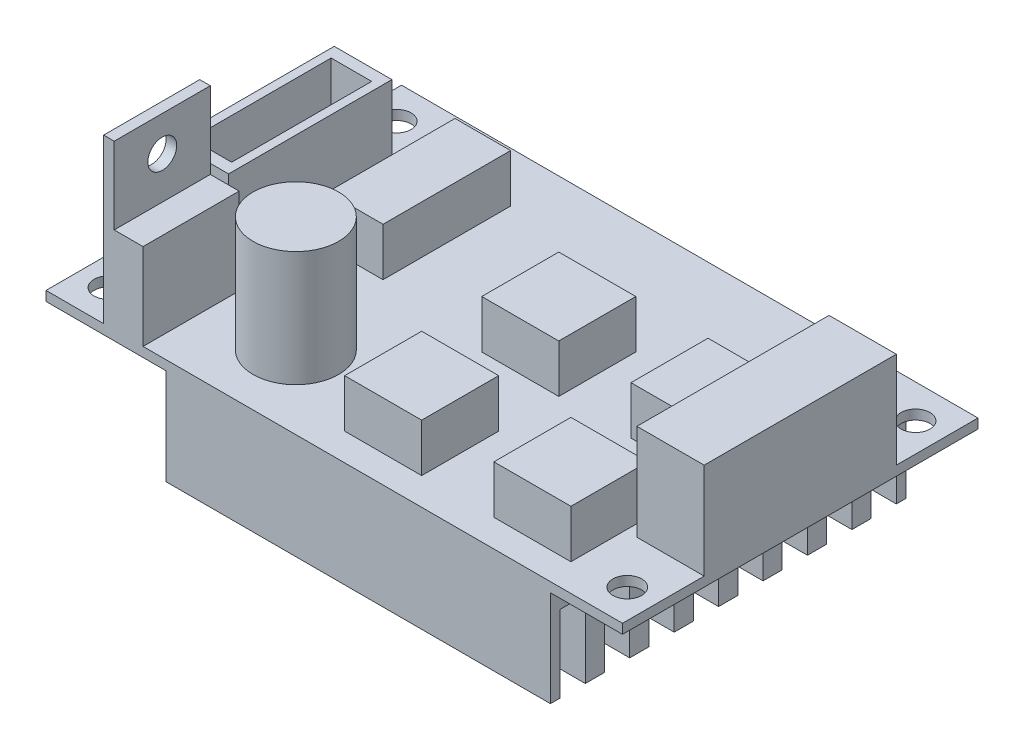
from build123d import *

# Parameters (mm, degrees)
SKETCH_1_W          = 60
SKETCH_1_H          = 37
SKETCH_1_R          = 1.5
EXTRUDE_1_DEPTH     = 1
SKETCH_2_W          = 18
SKETCH_2_H          = 20
EXTRUDE_2_DEPTH     = 10
SKETCH_3_R          = 1
CUT_EXTRUDE_1_DEPTH = 1
SKETCH_4_W          = 1.889309118
SKETCH_4_H          = 3.828785833
CUT_EXTRUDE_2_DEPTH = 5
SKETCH_5_W          = 6
SKETCH_5_H          = 17
EXTRUDE_3_DEPTH     = 7
SKETCH_6_W          = 4.219200818
SKETCH_6_H          = 14.571651166
CUT_EXTRUDE_3_DEPTH = 7
SKETCH_7_W          = 1.099481737
SKETCH_7_H          = 10
EXTRUDE_4_DEPTH     = 17
SKETCH_8_W          = 3
SKETCH_8_H          = 10
EXTRUDE_5_DEPTH     = 9
SKETCH_9_R          = 1.5
CUT_EXTRUDE_4_DEPTH = 9
SKETCH_10_W         = 8.015050441
SKETCH_10_H         = 8.015050442
SKETCH_10_W_2       = 5.788647541
SKETCH_10_H_2       = 13.284723362
EXTRUDE_7_DEPTH     = 5
SKETCH_11_R         = 4.452805801
EXTRUDE_8_DEPTH     = 12
SKETCH_12_W         = 40
SKETCH_12_H         = 37
EXTRUDE_9_DEPTH     = 10
SKETCH_13_W         = 2.63
SKETCH_13_H         = 7.995738943
CUT_EXTRUDE_5_DEPTH = 64.941379403
SKETCH_14_W         = 11
SKETCH_14_H         = 20
CUT_EXTRUDE_6_DEPTH = 49.448426187


with BuildPart() as part:
    # 草图1 → 凸台-拉伸1 (new body)
    with BuildSketch(Plane(origin=(0, 0, 0), x_dir=(1, 0, 0), z_dir=(0, 1, 0))):
        Rectangle(SKETCH_1_W, SKETCH_1_H)
        with Locations(Location((27, 15, 0), (0, 0, 270))):
            Circle(SKETCH_1_R, mode=Mode.SUBTRACT)
        with Locations(Location((27, -15, 0), (0, 0, 90))):
            Circle(SKETCH_1_R, mode=Mode.SUBTRACT)
        with Locations(Location((-27, -15, 0), (0, 0, 270))):
            Circle(SKETCH_1_R, mode=Mode.SUBTRACT)
        with Locations(Location((-27, 15, 0), (0, 0, 90))):
            Circle(SKETCH_1_R, mode=Mode.SUBTRACT)
    extrude(amount=EXTRUDE_1_DEPTH)

    # 草图2 → 凸台-拉伸2 (add)
    with BuildSketch(Plane(origin=(0, 1, 0), x_dir=(1, 0, 0), z_dir=(0, 1, 0))):
        with Locations((32, 0)):
            Rectangle(SKETCH_2_W, SKETCH_2_H)
    extrude(amount=EXTRUDE_2_DEPTH)

    # 草图3 → 切除-拉伸1 (cut)
    with BuildSketch(Plane(origin=(0, 11, 0), x_dir=(1, 0, 0), z_dir=(0, 1, 0))):
        with Locations(Location((38.562083072, 7.5, 0), (0, 0, 270))):
            Circle(SKETCH_3_R)
        with Locations(Location((38.562083072, 2.5, 0), (0, 0, 270))):
            Circle(SKETCH_3_R)
        with Locations(Location((38.562083072, -7.5, 0), (0, 0, 90))):
            Circle(SKETCH_3_R)
        with Locations(Location((38.562083072, -2.5, 0), (0, 0, 90))):
            Circle(SKETCH_3_R)
    extrude(amount=-CUT_EXTRUDE_1_DEPTH, mode=Mode.SUBTRACT)

    # 草图4 → 切除-拉伸2 (cut)
    with BuildSketch(Plane(origin=(41, 0, 0), x_dir=(0, 0, -1), z_dir=(1, 0, 0))):
        with Locations((-2.5, 3.73063685)):
            Rectangle(SKETCH_4_W, SKETCH_4_H)
        with Locations((-7.5, 3.73063685)):
            Rectangle(SKETCH_4_W, SKETCH_4_H)
        with Locations((2.5, 3.73063685)):
            Rectangle(SKETCH_4_W, SKETCH_4_H)
        with Locations((7.5, 3.73063685)):
            Rectangle(SKETCH_4_W, SKETCH_4_H)
    extrude(amount=-CUT_EXTRUDE_2_DEPTH, mode=Mode.SUBTRACT)

    # 草图5 → 凸台-拉伸3 (add)
    with BuildSketch(Plane(origin=(0, 1, 0), x_dir=(1, 0, 0), z_dir=(0, 1, 0))):
        with Locations((-27, 3)):
            Rectangle(SKETCH_5_W, SKETCH_5_H)
    extrude(amount=EXTRUDE_3_DEPTH)

    # 草图6 → 切除-拉伸3 (cut)
    with BuildSketch(Plane(origin=(0, 8, 0), x_dir=(1, 0, 0), z_dir=(0, 1, 0))):
        with Locations((-27, 3)):
            Rectangle(SKETCH_6_W, SKETCH_6_H)
    extrude(amount=-CUT_EXTRUDE_3_DEPTH, mode=Mode.SUBTRACT)

    # 草图7 → 凸台-拉伸4 (add)
    with BuildSketch(Plane(origin=(0, 1, 0), x_dir=(1, 0, 0), z_dir=(0, 1, 0))):
        with Locations((-23.450259132, -13.5)):
            Rectangle(SKETCH_7_W, SKETCH_7_H)
    extrude(amount=EXTRUDE_4_DEPTH)

    # 草图8 → 凸台-拉伸5 (add)
    with BuildSketch(Plane(origin=(0, 1, 0), x_dir=(1, 0, 0), z_dir=(0, 1, 0))):
        with Locations((-21.400518263, -13.5)):
            Rectangle(SKETCH_8_W, SKETCH_8_H)
    extrude(amount=EXTRUDE_5_DEPTH)

    # 草图9 → 切除-拉伸4 (cut)
    with BuildSketch(Plane(origin=(-22.900518263, 0, 0), x_dir=(0, 0, -1), z_dir=(1, 0, 0))):
        with Locations((-13.5, 14.366101357)):
            Circle(SKETCH_9_R)
    extrude(amount=-CUT_EXTRUDE_4_DEPTH, mode=Mode.SUBTRACT)

    # 草图10 → 凸台-拉伸7 (add)
    with BuildSketch(Plane(origin=(0, 1, 0), x_dir=(1, 0, 0), z_dir=(0, 1, 0))):
        with Locations((2.23408969, 2.63483646)):
            Rectangle(SKETCH_10_W, SKETCH_10_H)
        with Locations((-16.318748425, 6.642361681)):
            Rectangle(SKETCH_10_W_2, SKETCH_10_H_2)
        with Locations((17.76591031, 2.63483646)):
            Rectangle(SKETCH_10_W, SKETCH_10_H)
        with Locations((17.76591031, -11.63483646)):
            Rectangle(SKETCH_10_W, SKETCH_10_H)
        with Locations((2.23408969, -11.63483646)):
            Rectangle(SKETCH_10_W, SKETCH_10_H)
    extrude(amount=EXTRUDE_7_DEPTH)

    # 草图11 → 凸台-拉伸8 (add)
    with BuildSketch(Plane(origin=(0, 1, 0), x_dir=(1, 0, 0), z_dir=(0, 1, 0))):
        with Locations(Location((-11.643302333, -10.85371414, 0), (0, 0, 270))):
            Circle(SKETCH_11_R)
    extrude(amount=EXTRUDE_8_DEPTH)

    # 草图12 → 凸台-拉伸9 (add)
    with BuildSketch(Plane.XZ):
        with Locations((2.5, 0)):
            Rectangle(SKETCH_12_W, SKETCH_12_H)
    extrude(amount=EXTRUDE_9_DEPTH)

    # 草图13 → 切除-拉伸5 (cut, through all)
    with BuildSketch(Plane.ZY.offset(17.5)):
        with Locations((-16.185, -6.002130529)):
            Rectangle(SKETCH_13_W, SKETCH_13_H)
        with Locations((-11.565, -6.002130529)):
            Rectangle(SKETCH_13_W, SKETCH_13_H)
        with Locations((-6.935, -6.002130529)):
            Rectangle(SKETCH_13_W, SKETCH_13_H)
        with Locations((-2.315, -6.002130529)):
            Rectangle(SKETCH_13_W, SKETCH_13_H)
        with Locations((2.315, -6.002130529)):
            Rectangle(SKETCH_13_W, SKETCH_13_H)
        with Locations((6.935, -6.002130529)):
            Rectangle(SKETCH_13_W, SKETCH_13_H)
        with Locations((11.565, -6.002130529)):
            Rectangle(SKETCH_13_W, SKETCH_13_H)
        with Locations((16.185, -6.002130529)):
            Rectangle(SKETCH_13_W, SKETCH_13_H)
    extrude(amount=-CUT_EXTRUDE_5_DEPTH, mode=Mode.SUBTRACT)

    # 草图14 → 切除-拉伸6 (cut, through all)
    with BuildSketch(Plane.XZ):
        with Locations((35.5, 0)):
            Rectangle(SKETCH_14_W, SKETCH_14_H)
    extrude(amount=-CUT_EXTRUDE_6_DEPTH, mode=Mode.SUBTRACT)


solid = part.part
